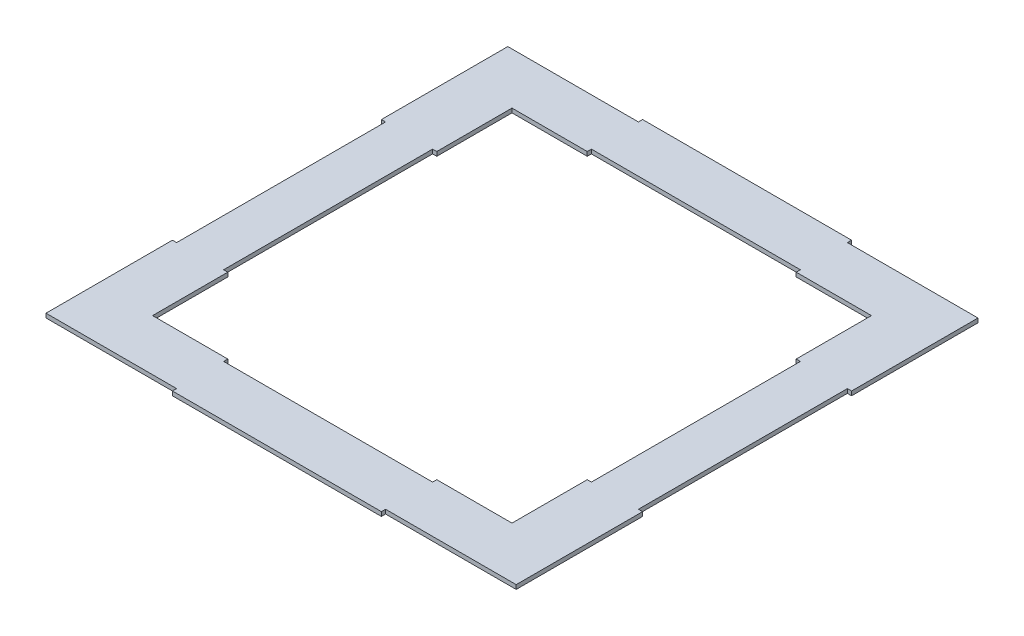
from build123d import *

# Parameters (mm, degrees)
BOSS_EXTRUDE1_DEPTH = 4


with BuildPart() as part:
    # Sketch1 → Boss-Extrude1 (new body)
    with BuildSketch(Plane(origin=(0, 0, 0), x_dir=(1, 0, 0), z_dir=(0, 1, 0))):
        Polygon((-225.234909125, 99.882545437), (-225.234909125, 220.882545437), (-100.234909125, 220.882545437), (-100.234909125, 224.882545437), (99.765090875, 224.882545437), (99.765090875, 220.882545437), (224.765090875, 220.882545437), (224.765090875, 99.882545437), (220.765090875, 99.882545437), (220.765090875, -100.117454563), (224.765090875, -100.117454563), (224.765090875, -221.117454563), (99.765090875, -221.117454563), (99.765090875, -225.117454563), (-100.234909125, -225.117454563), (-100.234909125, -221.117454563), (-225.234909125, -221.117454563), (-225.234909125, -100.117454563), (-221.234909125, -100.117454563), (-221.234909125, 99.882545437), align=None)
        Polygon((-172.234909125, -172.117454563), (-100.234909125, -172.117454563), (-100.234909125, -176.117454563), (99.765090875, -176.117454563), (99.765090875, -172.117454563), (171.765090875, -172.117454563), (171.765090875, -100.117454563), (175.765090875, -100.117454563), (175.765090875, 99.882545437), (171.765090875, 99.882545437), (171.765090875, 171.882545437), (99.765090875, 171.882545437), (99.765090875, 175.882545437), (-100.234909125, 175.882545437), (-100.234909125, 171.882545437), (-172.234909125, 171.882545437), (-172.234909125, 99.882545437), (-176.234909125, 99.882545437), (-176.234909125, -100.117454563), (-172.234909125, -100.117454563), align=None, mode=Mode.SUBTRACT)
    extrude(amount=BOSS_EXTRUDE1_DEPTH)


solid = part.part
